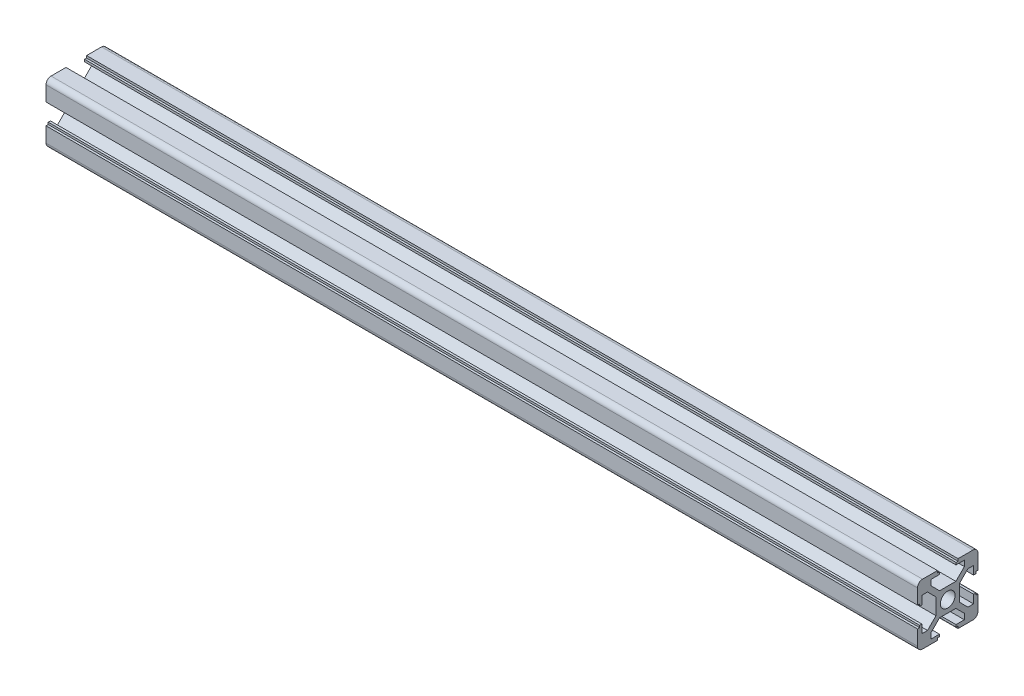
from build123d import *

# Parameters (mm, degrees)
SKETCH1_R                           = 3.65
BOSCHREXROTH_BOSCH_30X30_V2_1_DEPTH = 431.8


with BuildPart() as part:
    # Sketch1 → Boschrexroth BOSCH_30X30_V2(1) (new body)
    with BuildSketch(Plane(origin=(-215.9, 0, 0), x_dir=(0, 0, -1), z_dir=(1, 0, 0))):
        with BuildLine():
            Line((0, 5.8), (-4.03, 5.8))
            Line((-4.03, 5.8), (-8.25, 10.02))
            Line((-8.25, 10.02), (-8.25, 12.8))
            Line((-8.25, 12.8), (-4.1, 12.8))
            Line((-4.1, 12.8), (-4.1, 13.9))
            Line((-4.1, 13.9), (-5.1, 13.9))
            Line((-5.1, 13.9), (-5.1, 15))
            Line((-5.1, 15), (-12.5, 15))
            ThreePointArc((-12.5, 15), (-14.267766953, 14.267766953), (-15, 12.5))
            Line((-15, 12.5), (-15, 5.1))
            Line((-15, 5.1), (-13.9, 5.1))
            Line((-13.9, 5.1), (-13.9, 4.1))
            Line((-13.9, 4.1), (-12.8, 4.1))
            Line((-12.8, 4.1), (-12.8, 8.25))
            Line((-12.8, 8.25), (-10.02, 8.25))
            Line((-10.02, 8.25), (-5.8, 4.03))
            Line((-5.8, 4.03), (-5.8, 0))
            Line((-5.8, 0), (-5.8, -4.03))
            Line((-5.8, -4.03), (-10.02, -8.25))
            Line((-10.02, -8.25), (-12.8, -8.25))
            Line((-12.8, -8.25), (-12.8, -4.1))
            Line((-12.8, -4.1), (-13.9, -4.1))
            Line((-13.9, -4.1), (-13.9, -5.1))
            Line((-13.9, -5.1), (-15, -5.1))
            Line((-15, -5.1), (-15, -12.5))
            ThreePointArc((-15, -12.5), (-14.267766953, -14.267766953), (-12.5, -15))
            Line((-12.5, -15), (-5.1, -15))
            Line((-5.1, -15), (-5.1, -13.9))
            Line((-5.1, -13.9), (-4.1, -13.9))
            Line((-4.1, -13.9), (-4.1, -12.8))
            Line((-4.1, -12.8), (-8.25, -12.8))
            Line((-8.25, -12.8), (-8.25, -10.02))
            Line((-8.25, -10.02), (-4.03, -5.8))
            Line((-4.03, -5.8), (4.03, -5.8))
            Line((4.03, -5.8), (8.25, -10.02))
            Line((8.25, -10.02), (8.25, -12.8))
            Line((8.25, -12.8), (4.1, -12.8))
            Line((4.1, -12.8), (4.1, -13.9))
            Line((4.1, -13.9), (5.1, -13.9))
            Line((5.1, -13.9), (5.1, -15))
            Line((5.1, -15), (12.5, -15))
            ThreePointArc((12.5, -15), (14.267766953, -14.267766953), (15, -12.5))
            Line((15, -12.5), (15, -5.1))
            Line((15, -5.1), (13.9, -5.1))
            Line((13.9, -5.1), (13.9, -4.1))
            Line((13.9, -4.1), (12.8, -4.1))
            Line((12.8, -4.1), (12.8, -8.25))
            Line((12.8, -8.25), (10.02, -8.25))
            Line((10.02, -8.25), (5.8, -4.03))
            Line((5.8, -4.03), (5.8, 0))
            Line((5.8, 0), (5.8, 4.03))
            Line((5.8, 4.03), (10.02, 8.25))
            Line((10.02, 8.25), (12.8, 8.25))
            Line((12.8, 8.25), (12.8, 4.1))
            Line((12.8, 4.1), (13.9, 4.1))
            Line((13.9, 4.1), (13.9, 5.1))
            Line((13.9, 5.1), (15, 5.1))
            Line((15, 5.1), (15, 12.5))
            ThreePointArc((15, 12.5), (14.267766953, 14.267766953), (12.5, 15))
            Line((12.5, 15), (5.1, 15))
            Line((5.1, 15), (5.1, 13.9))
            Line((5.1, 13.9), (4.1, 13.9))
            Line((4.1, 13.9), (4.1, 12.8))
            Line((4.1, 12.8), (8.25, 12.8))
            Line((8.25, 12.8), (8.25, 10.02))
            Line((8.25, 10.02), (4.03, 5.8))
            Line((4.03, 5.8), (0, 5.8))
        make_face()
        Circle(SKETCH1_R, mode=Mode.SUBTRACT)
    extrude(amount=BOSCHREXROTH_BOSCH_30X30_V2_1_DEPTH)


solid = part.part
